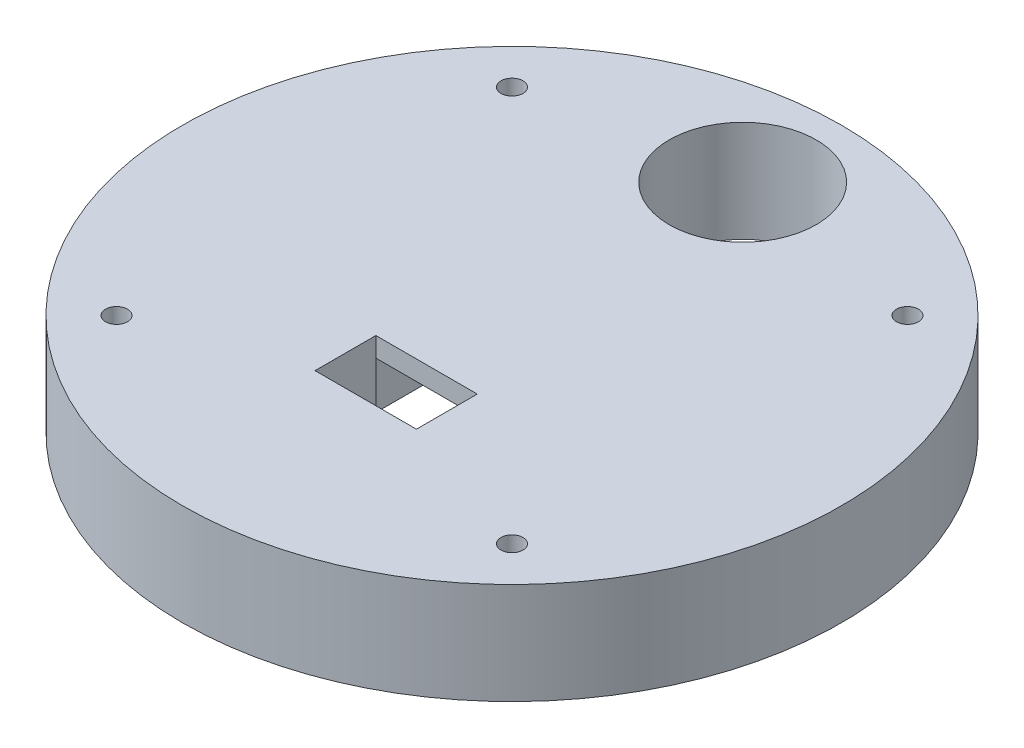
from build123d import *

# Parameters (mm, degrees)
SKETCH1_R           = 82.55
SKETCH1_R_2         = 18.415
BOSS_EXTRUDE3_DEPTH = 25.4
SKETCH1_7_W         = 42.799
SKETCH1_7_H         = 42.799
CUT_EXTRUDE2_DEPTH  = 20.5
SKETCH3_W           = 25.4
SKETCH3_H           = 15.24
CUT_EXTRUDE3_DEPTH  = 120.474537036
SKETCH1_8_R         = 2.75
CUT_EXTRUDE4_DEPTH  = 6
CUT_EXTRUDE5_START  = 19.4
SKETCH1_10_R        = 2.75
CUT_EXTRUDE5_DEPTH  = 6


with BuildPart() as part:
    # Sketch1 → Boss-Extrude3 (new body)
    with BuildSketch(Plane(origin=(0, 0, 0), x_dir=(1, 0, 0), z_dir=(0, 1, 0))):
        Circle(SKETCH1_R)
        with Locations((0, 57.785)):
            Circle(SKETCH1_R_2, mode=Mode.SUBTRACT)
    extrude(amount=BOSS_EXTRUDE3_DEPTH)

    # Sketch1<7> → Cut-Extrude2 (cut)
    with BuildSketch(Plane(origin=(0, 0, 0), x_dir=(1, 0, 0), z_dir=(0, 1, 0))):
        Rectangle(SKETCH1_7_W, SKETCH1_7_H)
    extrude(amount=CUT_EXTRUDE2_DEPTH, mode=Mode.SUBTRACT)

    # Sketch3 → Cut-Extrude3 (cut, through all)
    with BuildSketch(Plane.XZ):
        with Locations((0, 29.0195)):
            Rectangle(SKETCH3_W, SKETCH3_H)
    extrude(amount=-CUT_EXTRUDE3_DEPTH, mode=Mode.SUBTRACT)

    # Sketch1<8> → Cut-Extrude4 (cut)
    with BuildSketch(Plane(origin=(0, 0, 0), x_dir=(1, 0, 0), z_dir=(0, 1, 0))):
        with Locations((-49.53, 49.53)):
            Circle(SKETCH1_8_R)
        with Locations((49.53, 49.53)):
            Circle(SKETCH1_8_R)
        with Locations((49.53, -49.53)):
            Circle(SKETCH1_8_R)
        with Locations((-49.53, -49.53)):
            Circle(SKETCH1_8_R)
    extrude(amount=CUT_EXTRUDE4_DEPTH, mode=Mode.SUBTRACT)

    # Sketch1<10> → Cut-Extrude5 (cut)
    with BuildSketch(Plane(origin=(0, 0, 0), x_dir=(1, 0, 0), z_dir=(0, 1, 0)).offset(CUT_EXTRUDE5_START)):
        with Locations((-49.53, 49.53)):
            Circle(SKETCH1_10_R)
        with Locations((49.53, 49.53)):
            Circle(SKETCH1_10_R)
        with Locations((49.53, -49.53)):
            Circle(SKETCH1_10_R)
        with Locations((-49.53, -49.53)):
            Circle(SKETCH1_10_R)
    extrude(amount=CUT_EXTRUDE5_DEPTH, mode=Mode.SUBTRACT)


solid = part.part
